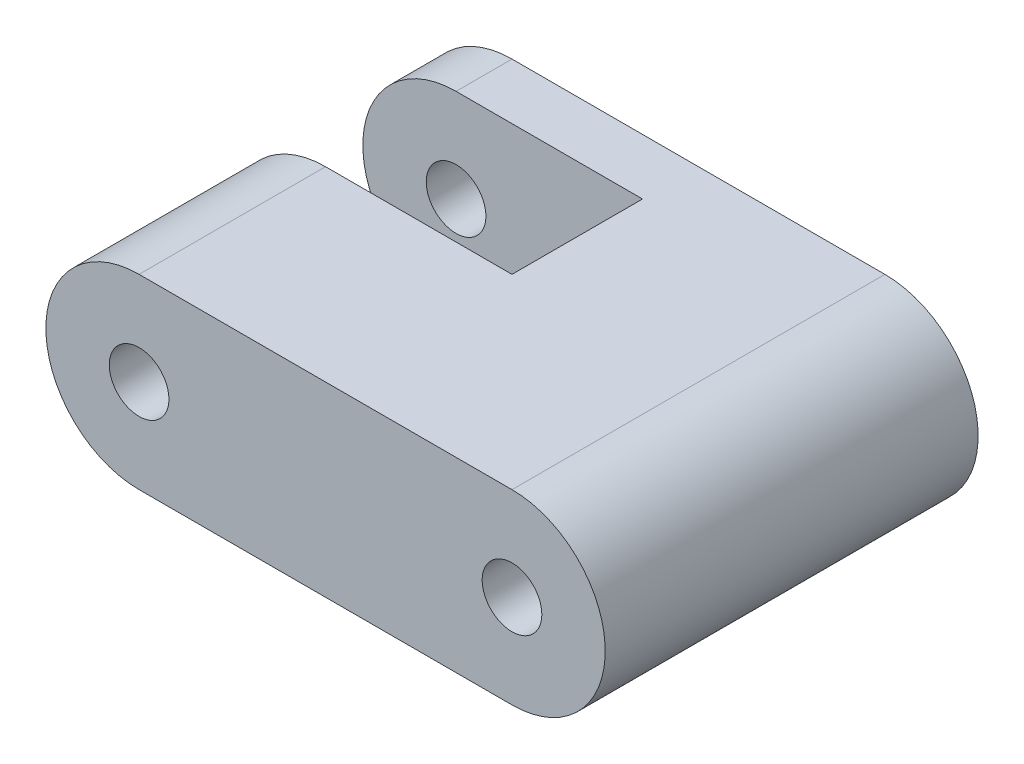
from build123d import *

# Parameters (mm, degrees)
SKETCH1_R           = 1.6
BOSS_EXTRUDE1_DEPTH = 20
SKETCH2_W           = 15
SKETCH2_H           = 7
CUT_EXTRUDE1_DEPTH  = 34.541019662


with BuildPart() as part:
    # Sketch1 → Boss-Extrude1 (new body)
    with BuildSketch(Plane.XY):
        with BuildLine():
            Line((-20, 5), (0, 5))
            ThreePointArc((0, 5), (5, 0), (0, -5))
            Line((0, -5), (-20, -5))
            ThreePointArc((-20, -5), (-25, 0), (-20, 5))
        make_face()
        with Locations((-20, 0)):
            Circle(SKETCH1_R, mode=Mode.SUBTRACT)
        Circle(SKETCH1_R, mode=Mode.SUBTRACT)
    extrude(amount=BOSS_EXTRUDE1_DEPTH)

    # Sketch2 → Cut-Extrude1 (cut, through all)
    with BuildSketch(Plane(origin=(0, 5, 0), x_dir=(1, 0, 0), z_dir=(0, 1, 0))):
        with Locations((-17.5, -6.5)):
            Rectangle(SKETCH2_W, SKETCH2_H)
    extrude(amount=-CUT_EXTRUDE1_DEPTH, mode=Mode.SUBTRACT)


solid = part.part
